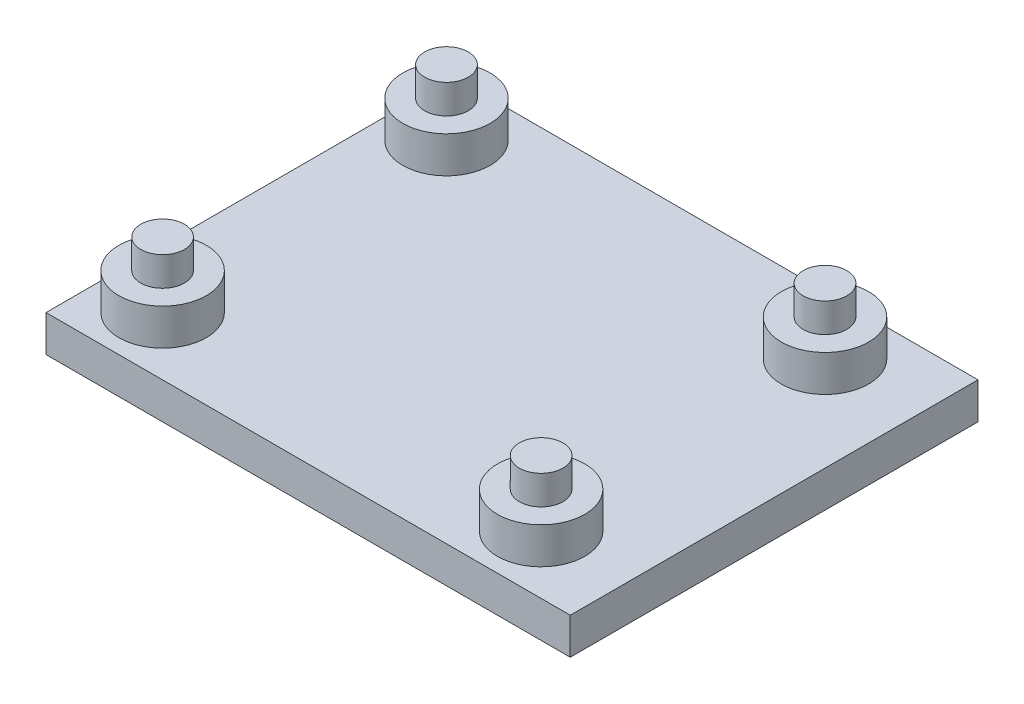
from build123d import *

# Parameters (mm, degrees)
SKETCH1_W           = 36
SKETCH1_H           = 28
BOSS_EXTRUDE1_DEPTH = 5
SKETCH2_R           = 1.5
BOSS_EXTRUDE2_DEPTH = 2
SKETCH3_W           = 36
SKETCH3_H           = 28
SKETCH3_R           = 3
CUT_EXTRUDE3_DEPTH  = 2.5


with BuildPart() as part:
    # Sketch1 → Boss-Extrude1 (new body)
    with BuildSketch(Plane(origin=(0, 0, 0), x_dir=(1, 0, 0), z_dir=(0, 1, 0))):
        Rectangle(SKETCH1_W, SKETCH1_H)
    extrude(amount=BOSS_EXTRUDE1_DEPTH)

    # Sketch2 → Boss-Extrude2 (add)
    with BuildSketch(Plane(origin=(0, 5, 0), x_dir=(1, 0, 0), z_dir=(0, 1, 0))):
        with Locations(Location((-14.5, 10, 0), (0, 0, 90))):
            Circle(SKETCH2_R)
        with Locations(Location((-14, -9.993749023, 0), (0, 0, 90))):
            Circle(SKETCH2_R)
        with Locations(Location((12, -10, 0), (0, 0, 90))):
            Circle(SKETCH2_R)
        with Locations(Location((11.499999249, 9.993749004, 0), (0, 0, 90))):
            Circle(SKETCH2_R)
    extrude(amount=BOSS_EXTRUDE2_DEPTH)

    # Sketch3 → Cut-Extrude3 (cut)
    with BuildSketch(Plane(origin=(0, 5, 0), x_dir=(1, 0, 0), z_dir=(0, 1, 0))):
        Rectangle(SKETCH3_W, SKETCH3_H)
        with Locations(Location((11.499999249, 9.993749004, 0), (0, 0, 270))):
            Circle(SKETCH3_R, mode=Mode.SUBTRACT)
        with Locations(Location((12, -10, 0), (0, 0, 270))):
            Circle(SKETCH3_R, mode=Mode.SUBTRACT)
        with Locations(Location((-14, -9.993749023, 0), (0, 0, 270))):
            Circle(SKETCH3_R, mode=Mode.SUBTRACT)
        with Locations(Location((-14.5, 10, 0), (0, 0, 270))):
            Circle(SKETCH3_R, mode=Mode.SUBTRACT)
    extrude(amount=-CUT_EXTRUDE3_DEPTH, mode=Mode.SUBTRACT)


solid = part.part
